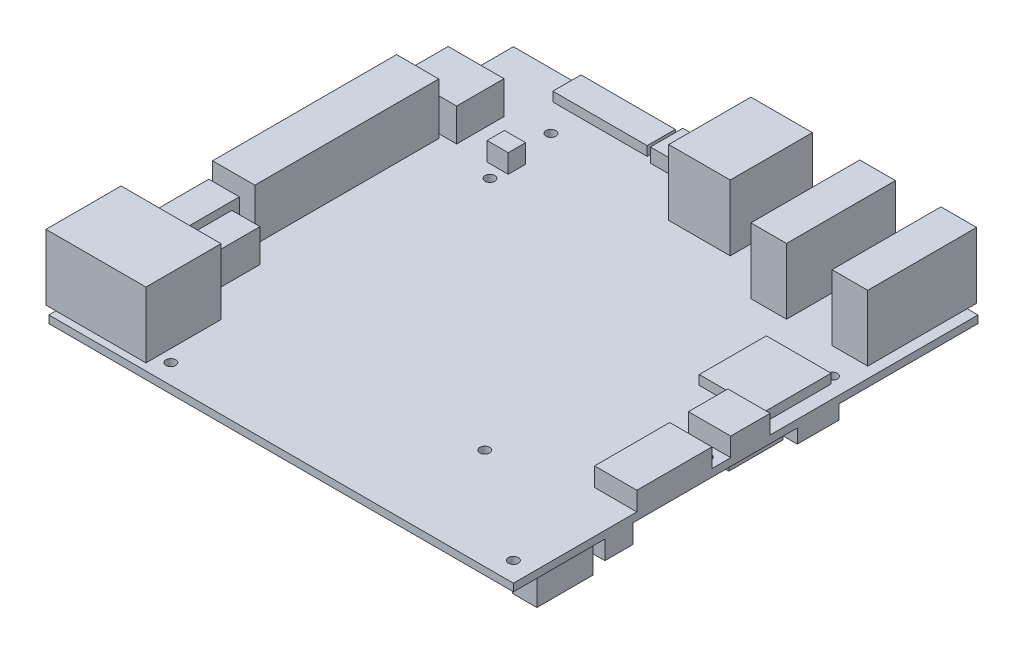
from build123d import *

# Parameters (mm, degrees)
SKETCH_1_W       = 99
SKETCH_1_H       = 99
SKETCH_1_R       = 1.05
EXTRUDE_1_DEPTH  = 1.6
SKETCH_2_W       = 7.6
SKETCH_2_H       = 23.2
SKETCH_2_W_2     = 13.1
SKETCH_2_H_2     = 17.5
SKETCH_2_W_3     = 21.3
SKETCH_2_H_3     = 16
EXTRUDE_2_DEPTH  = 14
SKETCH_3_W       = 8.6
SKETCH_3_H       = 6.9
EXTRUDE_3_DEPTH  = 3
SKETCH_4_W       = 20.1
SKETCH_4_H       = 6
SKETCH_4_W_2     = 13.8
SKETCH_4_H_2     = 14.3
EXTRUDE_4_DEPTH  = 2
SKETCH_5_W       = 11.9
SKETCH_5_H       = 10.1
SKETCH_5_W_2     = 6
SKETCH_5_H_2     = 13
EXTRUDE_5_DEPTH  = 7
SKETCH_6_W       = 9
SKETCH_6_H       = 39.2
EXTRUDE_6_DEPTH  = 11
SKETCH_7_W       = 6.5
SKETCH_7_H       = 16
EXTRUDE_7_DEPTH  = 8
SKETCH_8_W       = 9
SKETCH_8_H       = 16
SKETCH_8_H_2     = 8.4
SKETCH_8_W_2     = 4.5
SKETCH_8_H_3     = 3.7
EXTRUDE_8_DEPTH  = 4
SKETCH_9_W       = 5.2
SKETCH_9_H       = 12
EXTRUDE_9_DEPTH  = 6
SKETCH_10_R      = 7.5
SKETCH_10_W      = 14.6
SKETCH_10_H      = 6
EXTRUDE_10_DEPTH = 4
SKETCH_11_W      = 4
SKETCH_11_H      = 11.6
SKETCH_11_W_2    = 16.2
SKETCH_11_H_2    = 6
EXTRUDE_11_DEPTH = 2
SKETCH_12_W      = 7.5
SKETCH_12_H      = 8.9
SKETCH_12_W_2    = 3.5
SKETCH_12_H_2    = 9.1
EXTRUDE_12_DEPTH = 3
SKETCH_13_W      = 7.4
SKETCH_13_H      = 21.9
SKETCH_13_W_2    = 6.9
EXTRUDE_13_DEPTH = 6.4
SKETCH_14_R      = 7.5
EXTRUDE_14_DEPTH = 8


with BuildPart() as part:
    # 草图1 → 凸台-拉伸1 (new body)
    with BuildSketch(Plane(origin=(0, 0, 0), x_dir=(1, 0, 0), z_dir=(0, 1, 0))):
        with Locations((49.5, -49.5)):
            Rectangle(SKETCH_1_W, SKETCH_1_H)
        with Locations(Location((21.8, -26.8, 0), (0, 0, 270))):
            Circle(SKETCH_1_R, mode=Mode.SUBTRACT)
        with Locations(Location((94.8, -26.8, 0), (0, 0, 270))):
            Circle(SKETCH_1_R, mode=Mode.SUBTRACT)
        with Locations(Location((21.8, -94.8, 0), (0, 0, 270))):
            Circle(SKETCH_1_R, mode=Mode.SUBTRACT)
        with Locations(Location((94.8, -94.8, 0), (0, 0, 270))):
            Circle(SKETCH_1_R, mode=Mode.SUBTRACT)
        with Locations(Location((8.7, -65.7, 0), (0, 0, 270))):
            Circle(SKETCH_1_R, mode=Mode.SUBTRACT)
        with Locations(Location((81.9, -4.6, 0), (0, 0, 270))):
            Circle(SKETCH_1_R, mode=Mode.SUBTRACT)
        with Locations(Location((96.3, -55.2, 0), (0, 0, 270))):
            Circle(SKETCH_1_R, mode=Mode.SUBTRACT)
        with Locations(Location((20, -12, 0), (0, 0, 270))):
            Circle(SKETCH_1_R, mode=Mode.SUBTRACT)
        with Locations(Location((71.4, -77.5, 0), (0, 0, 270))):
            Circle(SKETCH_1_R, mode=Mode.SUBTRACT)
    extrude(amount=EXTRUDE_1_DEPTH)

    # 草图2 → 凸台-拉伸2 (add)
    with BuildSketch(Plane(origin=(0, 1.6, 0), x_dir=(1, 0, 0), z_dir=(0, 1, 0))):
        with Locations((92.9, -9.6)):
            Rectangle(SKETCH_2_W, SKETCH_2_H)
        with Locations((75.6, -9.6)):
            Rectangle(SKETCH_2_W, SKETCH_2_H)
        with Locations((55.15, -6.75)):
            Rectangle(SKETCH_2_W_2, SKETCH_2_H_2)
        with Locations((8.55, -89.5)):
            Rectangle(SKETCH_2_W_3, SKETCH_2_H_3)
    extrude(amount=EXTRUDE_2_DEPTH)

    # 草图3 → 凸台-拉伸3 (add)
    with BuildSketch(Plane(origin=(0, 1.6, 0), x_dir=(1, 0, 0), z_dir=(0, 1, 0))):
        with Locations((40.4, -3.45)):
            Rectangle(SKETCH_3_W, SKETCH_3_H)
    extrude(amount=EXTRUDE_3_DEPTH)

    # 草图4 → 凸台-拉伸4 (add)
    with BuildSketch(Plane(origin=(0, 1.6, 0), x_dir=(1, 0, 0), z_dir=(0, 1, 0))):
        with Locations((24.45, -3)):
            Rectangle(SKETCH_4_W, SKETCH_4_H)
        with Locations((89.2, -35.55)):
            Rectangle(SKETCH_4_W_2, SKETCH_4_H_2)
    extrude(amount=EXTRUDE_4_DEPTH)

    # 草图5 → 凸台-拉伸5 (add)
    with BuildSketch(Plane(origin=(0, 1.6, 0), x_dir=(1, 0, 0), z_dir=(0, 1, 0))):
        with Locations((5.95, -18.95)):
            Rectangle(SKETCH_5_W, SKETCH_5_H)
        with Locations((10.2, -73.7)):
            Rectangle(SKETCH_5_W_2, SKETCH_5_H_2)
    extrude(amount=EXTRUDE_5_DEPTH)

    # 草图6 → 凸台-拉伸6 (add)
    with BuildSketch(Plane(origin=(0, 1.6, 0), x_dir=(1, 0, 0), z_dir=(0, 1, 0))):
        with Locations((4.5, -44.5)):
            Rectangle(SKETCH_6_W, SKETCH_6_H)
    extrude(amount=EXTRUDE_6_DEPTH)

    # 草图7 → 凸台-拉伸7 (add)
    with BuildSketch(Plane(origin=(0, 1.6, 0), x_dir=(1, 0, 0), z_dir=(0, 1, 0))):
        with Locations((3.25, -72.9)):
            Rectangle(SKETCH_7_W, SKETCH_7_H)
    extrude(amount=EXTRUDE_7_DEPTH)

    # 草图8 → 凸台-拉伸8 (add)
    with BuildSketch(Plane(origin=(0, 1.6, 0), x_dir=(1, 0, 0), z_dir=(0, 1, 0))):
        with Locations((94.5, -64.7)):
            Rectangle(SKETCH_8_W, SKETCH_8_H)
        with Locations((94.5, -48.5)):
            Rectangle(SKETCH_8_W, SKETCH_8_H_2)
        with Locations((20.75, -22.25)):
            Rectangle(SKETCH_8_W_2, SKETCH_8_H_3)
    extrude(amount=EXTRUDE_8_DEPTH)

    # 草图9 → 凸台-拉伸9 (add)
    with BuildSketch(Plane.XZ):
        with Locations((95.8, 87.4)):
            Rectangle(SKETCH_9_W, SKETCH_9_H)
    extrude(amount=EXTRUDE_9_DEPTH)

    # 草图10 → 凸台-拉伸10 (add)
    with BuildSketch(Plane.XZ):
        with Locations(Location((85.4, 55.4, 0), (0, 0, 90))):
            Circle(SKETCH_10_R)
        with Locations((91.7, 76.5)):
            Rectangle(SKETCH_10_W, SKETCH_10_H)
    extrude(amount=EXTRUDE_10_DEPTH)

    # 草图11 → 凸台-拉伸11 (add)
    with BuildSketch(Plane.XZ):
        with Locations((95.7, 46)):
            Rectangle(SKETCH_11_W, SKETCH_11_H)
        with Locations((26.3, 3)):
            Rectangle(SKETCH_11_W_2, SKETCH_11_H_2)
    extrude(amount=EXTRUDE_11_DEPTH)

    # 草图12 → 凸台-拉伸12 (add)
    with BuildSketch(Plane.XZ):
        with Locations((95.25, 34.05)):
            Rectangle(SKETCH_12_W, SKETCH_12_H)
        with Locations((37.85, 38.85)):
            Rectangle(SKETCH_12_W_2, SKETCH_12_H_2)
    extrude(amount=EXTRUDE_12_DEPTH)

    # 草图13 → 凸台-拉伸13 (add)
    with BuildSketch(Plane.XZ):
        with Locations((41.7, 77.45)):
            Rectangle(SKETCH_13_W, SKETCH_13_H)
        with Locations((16.25, 55.25)):
            Rectangle(SKETCH_13_W_2, SKETCH_13_H)
    extrude(amount=EXTRUDE_13_DEPTH)

    # 草图14 → 凸台-拉伸14 (add)
    with BuildSketch(Plane.XZ):
        with Locations(Location((50, 36.3, 0), (0, 0, 90))):
            Circle(SKETCH_14_R)
    extrude(amount=EXTRUDE_14_DEPTH)


solid = part.part
